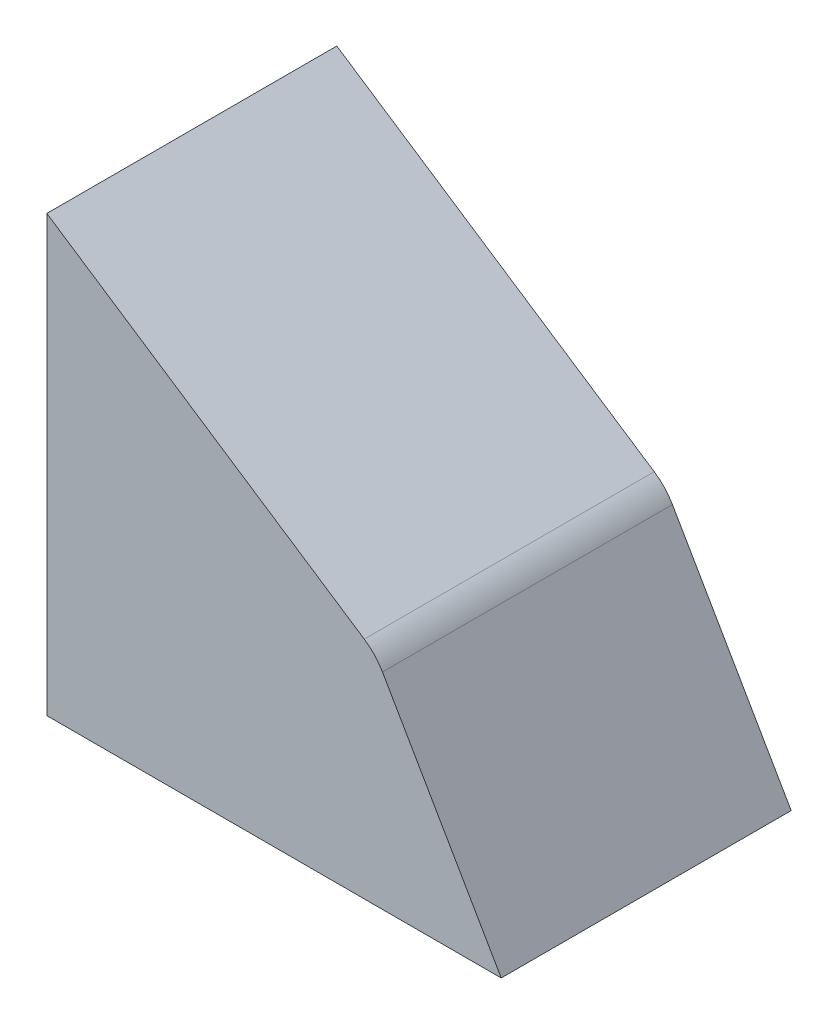
from build123d import *

# Parameters (mm, degrees)
BOSS_EXTRUDE1_DEPTH = 10
FILLET1_R           = 2


with BuildPart() as part:
    # Sketch2 → Boss-Extrude1 (new body)
    with BuildSketch(Plane.XY):
        Polygon((-8.660254038, 0), (-4.330127019, -7.5), (-20.000127019, -7.5), (-20.000127019, 7.5), align=None)
    extrude(amount=BOSS_EXTRUDE1_DEPTH)

    # Fillet1
    fillet1_edges = [part.edges().sort_by_distance(p)[0] for p in [
        (-8.660254038, 0, 5),
    ]]
    fillet(fillet1_edges, radius=FILLET1_R)


solid = part.part
